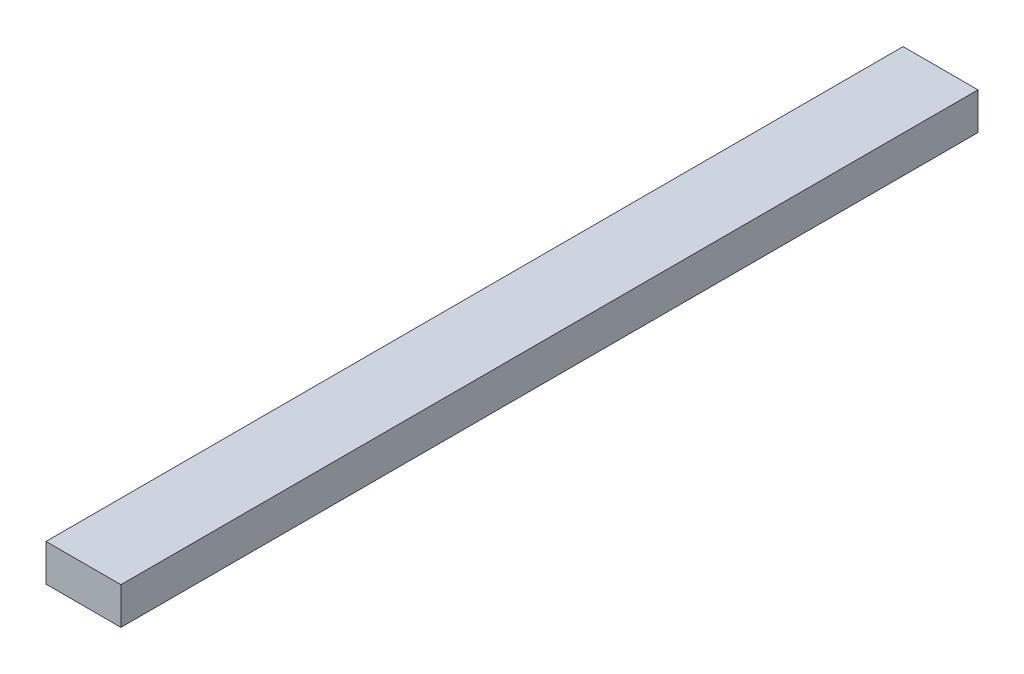
from build123d import *

# Parameters (mm, degrees)
SKETCH1_W           = 12.15
SKETCH1_H           = 6
BOSS_EXTRUDE1_DEPTH = 139


with BuildPart() as part:
    # Sketch1 → Boss-Extrude1 (new body)
    with BuildSketch(Plane.XY):
        Rectangle(SKETCH1_W, SKETCH1_H)
    extrude(amount=BOSS_EXTRUDE1_DEPTH)


solid = part.part
